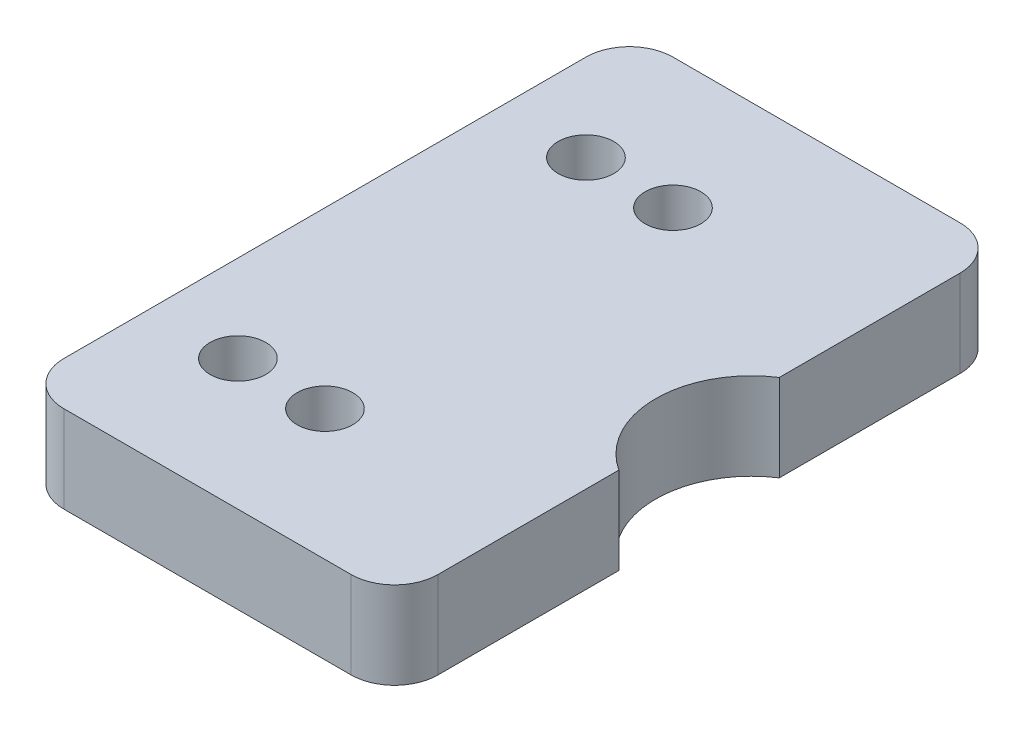
from build123d import *

# Parameters (mm, degrees)
SKETCH1_R           = 4.064
BOSS_EXTRUDE1_DEPTH = 12.7
FILLET1_R           = 6.35


with BuildPart() as part:
    # Sketch1 → Boss-Extrude1 (new body)
    with BuildSketch(Plane(origin=(0, 0, 0), x_dir=(1, 0, 0), z_dir=(0, 1, 0))):
        with BuildLine():
            Line((54.61, 32.741178539), (54.61, 0))
            Line((54.61, 0), (0, 0))
            Line((0, 0), (0, 88.9))
            Line((0, 88.9), (54.61, 88.9))
            Line((54.61, 88.9), (54.61, 56.158821461))
            ThreePointArc((54.61, 56.158821461), (48.26, 44.45), (54.61, 32.741178539))
        make_face()
        with Locations(Location((12.7, 69.85, 0), (0, 0, 270))):
            Circle(SKETCH1_R, mode=Mode.SUBTRACT)
        with Locations(Location((25.4, 69.85, 0), (0, 0, 270))):
            Circle(SKETCH1_R, mode=Mode.SUBTRACT)
        with Locations(Location((25.4, 19.05, 0), (0, 0, 90))):
            Circle(SKETCH1_R, mode=Mode.SUBTRACT)
        with Locations(Location((12.7, 19.05, 0), (0, 0, 90))):
            Circle(SKETCH1_R, mode=Mode.SUBTRACT)
    extrude(amount=BOSS_EXTRUDE1_DEPTH)

    # Fillet1
    fillet1_edges = [part.edges().sort_by_distance(p)[0] for p in [
        (0, 6.35, -88.9),
        (54.61, 6.35, -88.9),
        (54.61, 6.35, 0),
        (0, 6.35, 0),
    ]]
    fillet(fillet1_edges, radius=FILLET1_R)


solid = part.part
